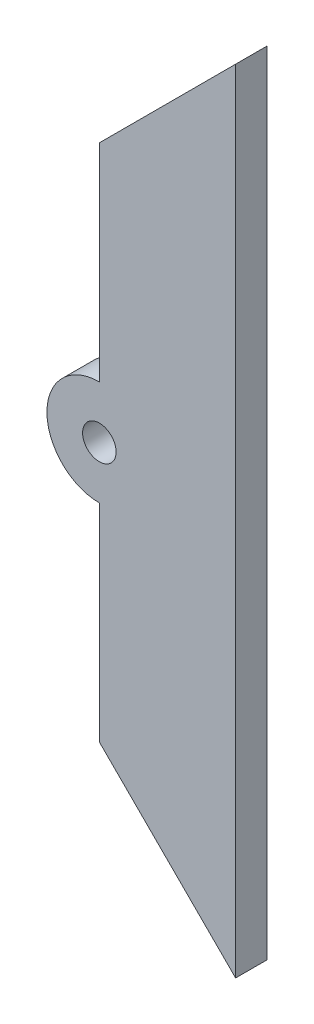
from build123d import *

# Parameters (mm, degrees)
SKETCH1_R           = 5
BOSS_EXTRUDE1_DEPTH = 3
CUT_EXTRUDE1_REACH  = 43.929
SKETCH2_R           = 1.6


with BuildPart() as part:
    # Sketch1 → Boss-Extrude1 (new body)
    with BuildSketch(Plane.XY):
        with Locations((-13, 0)):
            Circle(SKETCH1_R)
        Polygon((-13, -24.75), (-13, 24.75), (0, 37.75), (0, -37.75), align=None)
    extrude(amount=BOSS_EXTRUDE1_DEPTH)

    # Sketch2 → Cut-Extrude1 (cut, up to next)
    with BuildSketch(Plane.XY.offset(3), mode=Mode.PRIVATE) as cut_extrude1_sk1:
        with Locations((-13, 0)):
            Circle(SKETCH2_R)
    cut_extrude1_tool1 = extrude(cut_extrude1_sk1.sketch, amount=-CUT_EXTRUDE1_REACH, mode=Mode.PRIVATE) & part.part
    add(cut_extrude1_tool1.solids().sort_by_distance((-13, 0, 3))[0], mode=Mode.SUBTRACT)


solid = part.part
